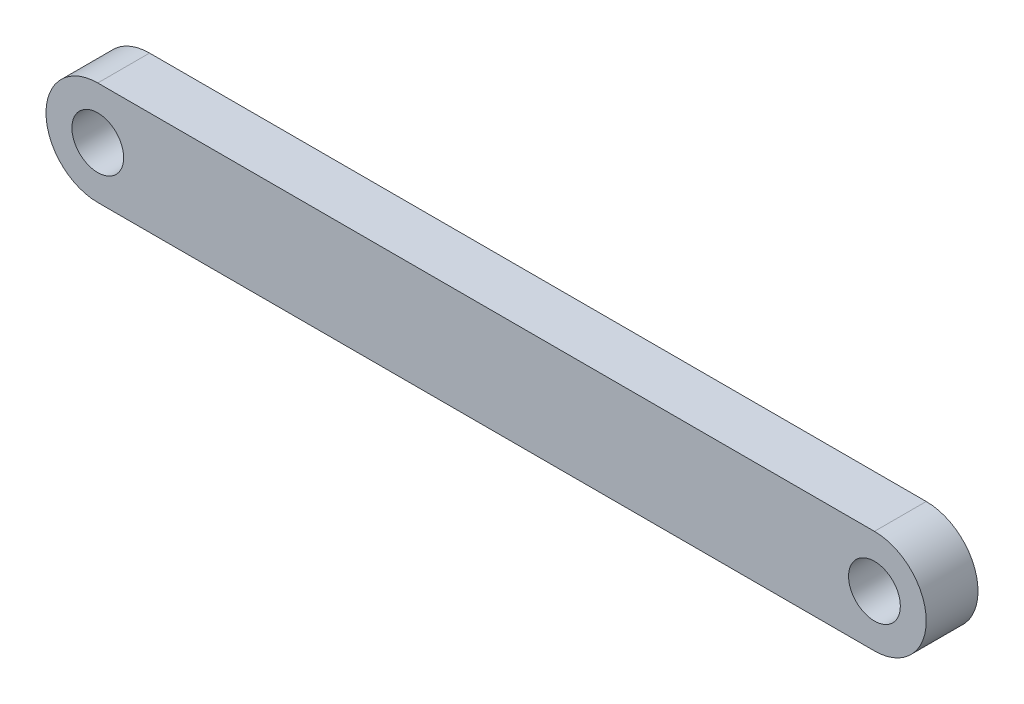
from build123d import *

# Parameters (mm, degrees)
SKETCH1_R           = 5
BOSS_EXTRUDE1_DEPTH = 10


with BuildPart() as part:
    # Sketch1 → Boss-Extrude1 (new body)
    with BuildSketch(Plane.XY):
        with BuildLine():
            Line((0, 10), (150, 10))
            ThreePointArc((150, 10), (160, 0), (150, -10))
            Line((150, -10), (0, -10))
            ThreePointArc((0, -10), (-10, 0), (0, 10))
        make_face()
        Circle(SKETCH1_R, mode=Mode.SUBTRACT)
        with Locations((150, 0)):
            Circle(SKETCH1_R, mode=Mode.SUBTRACT)
    extrude(amount=BOSS_EXTRUDE1_DEPTH)


solid = part.part
